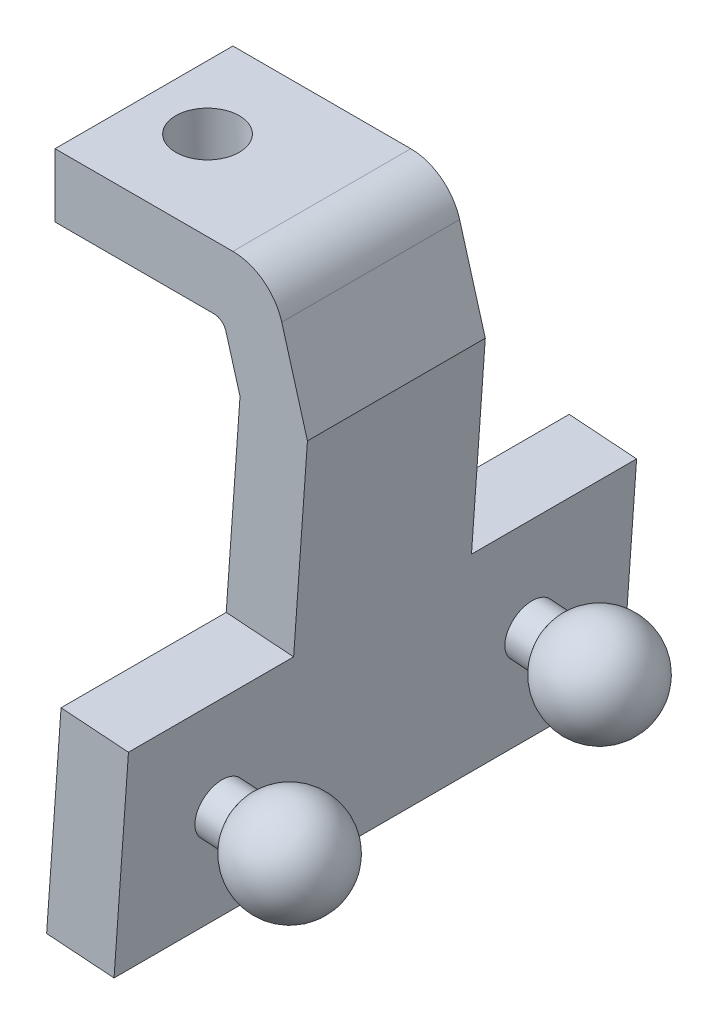
from build123d import *
from build123d.topology import SkipClean

# Parameters (mm, degrees)
EXTRUDE_1_DEPTH     = 3.5
SKETCH_2_R          = 1.25
CUT_EXTRUDE_3_DEPTH = 5.5
SKETCH_3_W          = 20
SKETCH_3_H          = 8
EXTRUDE_2_DEPTH     = 2.660444
SKETCH_4_R          = 1
EXTRUDE_3_DEPTH     = 1


with BuildPart() as part:
    # 草图1 → 凸台-拉伸1 (new, symmetric)
    with BuildSketch(Plane.XY):
        with BuildLine():
            Line((0, 0), (6.245432753, 0))
            ThreePointArc((6.245432753, 0), (6.54659813, -0.100876691), (6.72624124, -0.362802336))
            Line((6.72624124, -0.362802336), (7.280170813, -2.304045596))
            Line((7.280170813, -2.304045596), (6.168111785, -17.917350358))
            Line((6.168111785, -17.917350358), (8.821833549, -18.106361928))
            Line((8.821833549, -18.106361928), (9.933892576, -2.493057166))
            Line((9.933892576, -2.493057166), (8.923233948, 1.048790655))
            ThreePointArc((8.923233948, 1.048790655), (8.204661507, 2.096493237), (7, 2.5))
            Line((7, 2.5), (0, 2.5))
            Line((0, 2.5), (0, 0))
        make_face()
    extrude(amount=EXTRUDE_1_DEPTH, both=True)

    # 草图2 → 切除-拉伸3 (cut)
    with BuildSketch(Plane.XZ):
        with Locations((2.5, 0)):
            Circle(SKETCH_2_R)
    extrude(amount=-CUT_EXTRUDE_3_DEPTH, mode=Mode.SUBTRACT)

    # 草图3 → 凸台-拉伸2 (add)
    with SkipClean():  # the faces are left unmerged after this step: merging them gives an invalid solid
        with BuildSketch(Plane(origin=(10.06042413, -0.716554608, 0), x_dir=(0, 0, -1), z_dir=(0.9974731035002551, -0.07104511097583902, 0))):
            with Locations((0, -13.433860882)):
                Rectangle(SKETCH_3_W, SKETCH_3_H)
        extrude(amount=-EXTRUDE_2_DEPTH)

    # 草图4 → 凸台-拉伸3 (add)
    with SkipClean():  # the faces are left unmerged after this step: merging them gives an invalid solid
        with BuildSketch(Plane(origin=(10.06042413, -0.716554608, 0), x_dir=(0, 0, -1), z_dir=(0.9974731035002551, -0.07104511097583902, 0))):
            with Locations(Location((-6.099395407, -13.433860882, 0), (0, 0, 270))):
                Circle(SKETCH_4_R)
        extrude_3 = extrude(amount=EXTRUDE_3_DEPTH)

    # 草图5 → 旋转1 (revolve)
    with SkipClean():  # the faces are left unmerged after this step: merging them gives an invalid solid
        with BuildSketch(Plane(origin=(-0.954410137, -13.399914906, 0), x_dir=(-0.9974731035002551, 0.07104511097583902, 0), z_dir=(0.07104511097583903, 0.9974731035002552, 0))):
            with BuildLine():
                Line((-11.085910181, 6.099395407), (-14.817960988, 6.099395407))
                ThreePointArc((-14.817960988, 6.099395407), (-13.335599079, 8.031247059), (-11.085910181, 7.099395407))
                Line((-11.085910181, 7.099395407), (-11.085910181, 6.099395407))
            make_face()
        revolve_1 = revolve(axis=Axis((10.103487096, -14.187514625, 6.099395407), (0.9974731035002552, -0.071045110975839, 0)))

    # 镜向1: 凸台-拉伸3, 旋转1 across plane
    with SkipClean():  # the faces are left unmerged after this step: merging them gives an invalid solid
        add(extrude_3.mirror(Plane.XY))
        add(revolve_1.mirror(Plane.XY))


solid = part.part
